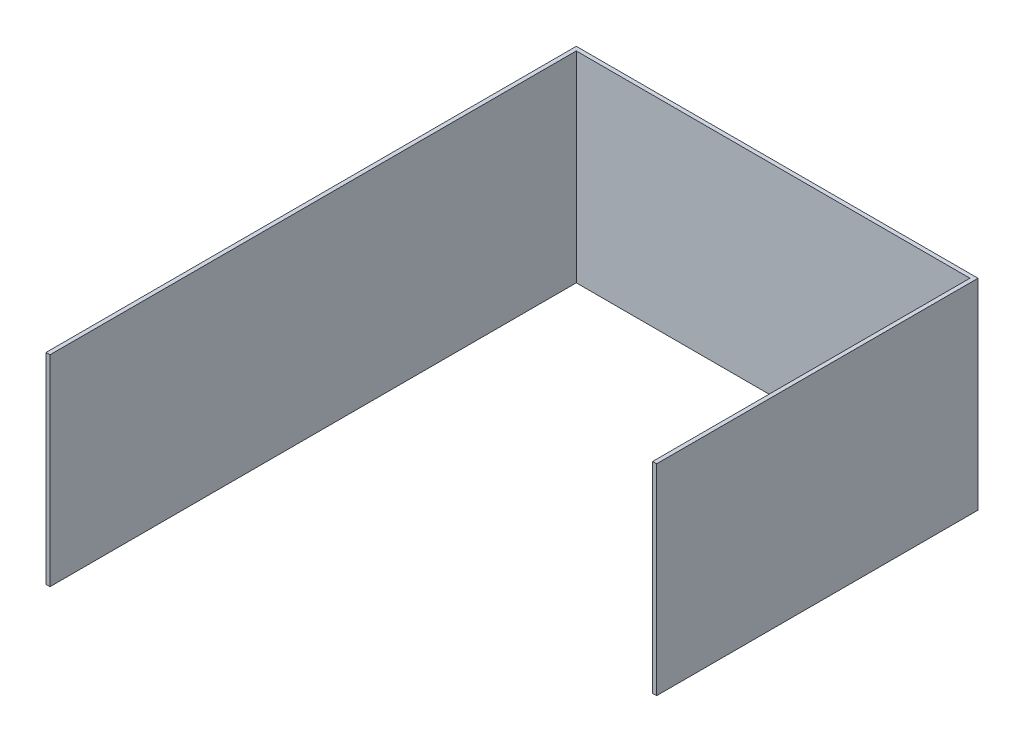
from build123d import *

# Parameters (mm, degrees)
BOSS_EXTRUDE1_DEPTH = 250
SKETCH3_W           = 5
SKETCH3_H           = 100
CUT_EXTRUDE1_DEPTH  = 250
SKETCH4_W           = 5
SKETCH4_H           = 250
BOSS_EXTRUDE2_DEPTH = 160


with BuildPart() as part:
    # Sketch1 → Boss-Extrude1 (new body)
    with BuildSketch(Plane(origin=(0, 0, 0), x_dir=(1, 0, 0), z_dir=(0, 1, 0))):
        Polygon((-250, 0), (-250, 500), (250, 500), (250, 0), (245, 0), (245, 495), (-245, 495), (-245, 0), align=None)
    extrude(amount=BOSS_EXTRUDE1_DEPTH)

    # Sketch3 → Cut-Extrude1 (cut)
    with BuildSketch(Plane(origin=(0, 250, 0), x_dir=(1, 0, 0), z_dir=(0, 1, 0))):
        with Locations((247.5, 50)):
            Rectangle(SKETCH3_W, SKETCH3_H)
    extrude(amount=-CUT_EXTRUDE1_DEPTH, mode=Mode.SUBTRACT)

    # Sketch4 → Boss-Extrude2 (add)
    with BuildSketch(Plane.XY):
        with Locations((-247.5, 125)):
            Rectangle(SKETCH4_W, SKETCH4_H)
    extrude(amount=BOSS_EXTRUDE2_DEPTH)


solid = part.part
